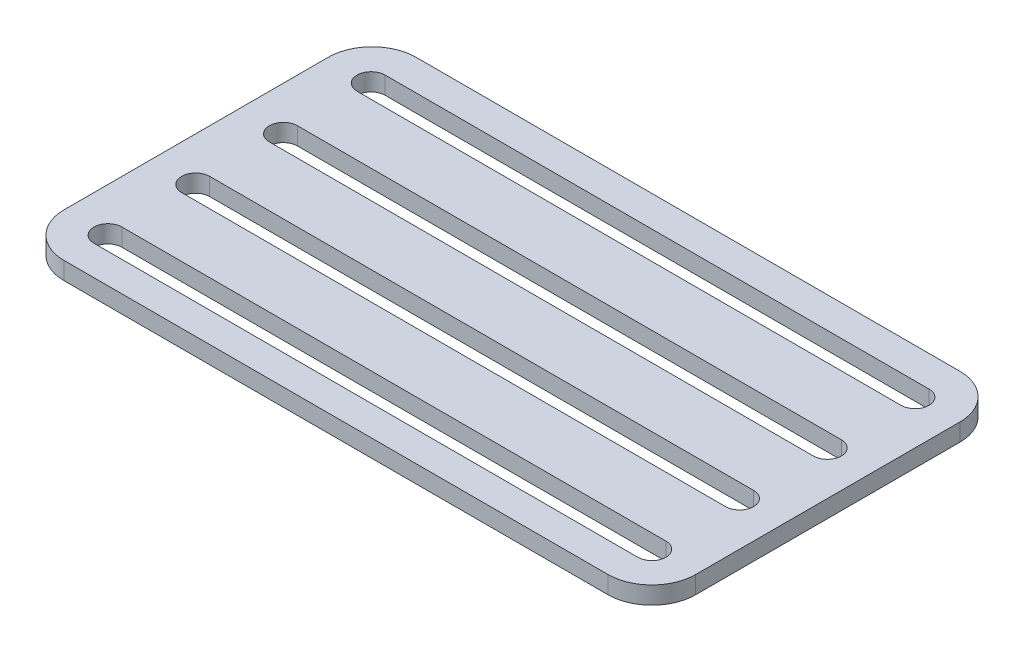
from build123d import *

# Parameters (mm, degrees)
EXTRUDE_1_DEPTH = 2


with BuildPart() as part:
    # 草图1 → 凸台-拉伸1 (new body)
    with BuildSketch(Plane(origin=(0, 0, 0), x_dir=(1, 0, 0), z_dir=(0, 1, 0))):
        with BuildLine():
            Line((31, 40.116685184), (-31, 40.116685184))
            ThreePointArc((-31, 40.116685184), (-34.535533906, 38.652219089), (-36, 35.116685184))
            Line((-36, 35.116685184), (-36, 5))
            ThreePointArc((-36, 5), (-34.535533906, 1.464466094), (-31, 0))
            Line((-31, 0), (31, 0))
            ThreePointArc((31, 0), (34.535533906, 1.464466094), (36, 5))
            Line((36, 5), (36, 35.116685184))
            ThreePointArc((36, 35.116685184), (34.535533906, 38.652219089), (31, 40.116685184))
        make_face()
        with BuildLine():
            Line((-31, 6.6), (0, 6.6))
            Line((0, 6.6), (31, 6.6))
            ThreePointArc((31, 6.6), (32.6, 5), (31, 3.4))
            Line((31, 3.4), (0, 3.4))
            Line((0, 3.4), (-31, 3.4))
            ThreePointArc((-31, 3.4), (-32.6, 5), (-31, 6.6))
        make_face(mode=Mode.SUBTRACT)
        with BuildLine():
            Line((-31, 16.6), (0, 16.6))
            Line((0, 16.6), (31, 16.6))
            ThreePointArc((31, 16.6), (32.6, 15), (31, 13.4))
            Line((31, 13.4), (0, 13.4))
            Line((0, 13.4), (-31, 13.4))
            ThreePointArc((-31, 13.4), (-32.6, 15), (-31, 16.6))
        make_face(mode=Mode.SUBTRACT)
        with BuildLine():
            Line((-31, 26.6), (0, 26.6))
            Line((0, 26.6), (31, 26.6))
            ThreePointArc((31, 26.6), (32.6, 25), (31, 23.4))
            Line((31, 23.4), (0, 23.4))
            Line((0, 23.4), (-31, 23.4))
            ThreePointArc((-31, 23.4), (-32.6, 25), (-31, 26.6))
        make_face(mode=Mode.SUBTRACT)
        with BuildLine():
            Line((-31, 36.6), (0, 36.6))
            Line((0, 36.6), (31, 36.6))
            ThreePointArc((31, 36.6), (32.6, 35), (31, 33.4))
            Line((31, 33.4), (0, 33.4))
            Line((0, 33.4), (-31, 33.4))
            ThreePointArc((-31, 33.4), (-32.6, 35), (-31, 36.6))
        make_face(mode=Mode.SUBTRACT)
    extrude(amount=EXTRUDE_1_DEPTH)


solid = part.part
